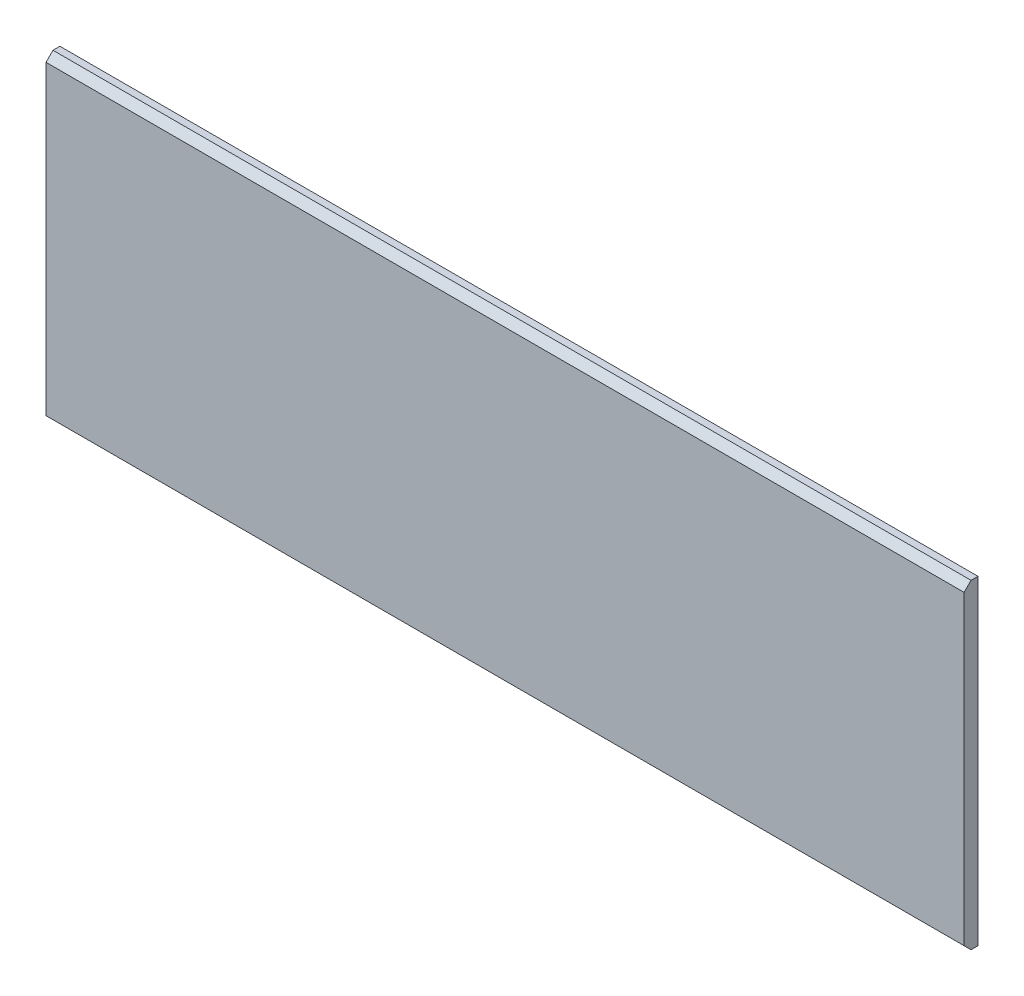
from build123d import *

# Parameters (mm, degrees)
SKETCH_1_W      = 660
SKETCH_1_H      = 230
EXTRUDE_1_DEPTH = 10
CHAMFER_1_SIZE  = 5


with BuildPart() as part:
    # 草图1 → 凸台-拉伸1 (new body)
    with BuildSketch(Plane.XY):
        Rectangle(SKETCH_1_W, SKETCH_1_H)
    extrude(amount=EXTRUDE_1_DEPTH)

    # 倒角1
    chamfer_1_edges = [part.edges().sort_by_distance(p)[0] for p in [
        (0, -115, 10),
        (0, 115, 10),
    ]]
    chamfer(chamfer_1_edges, length=CHAMFER_1_SIZE)


solid = part.part
